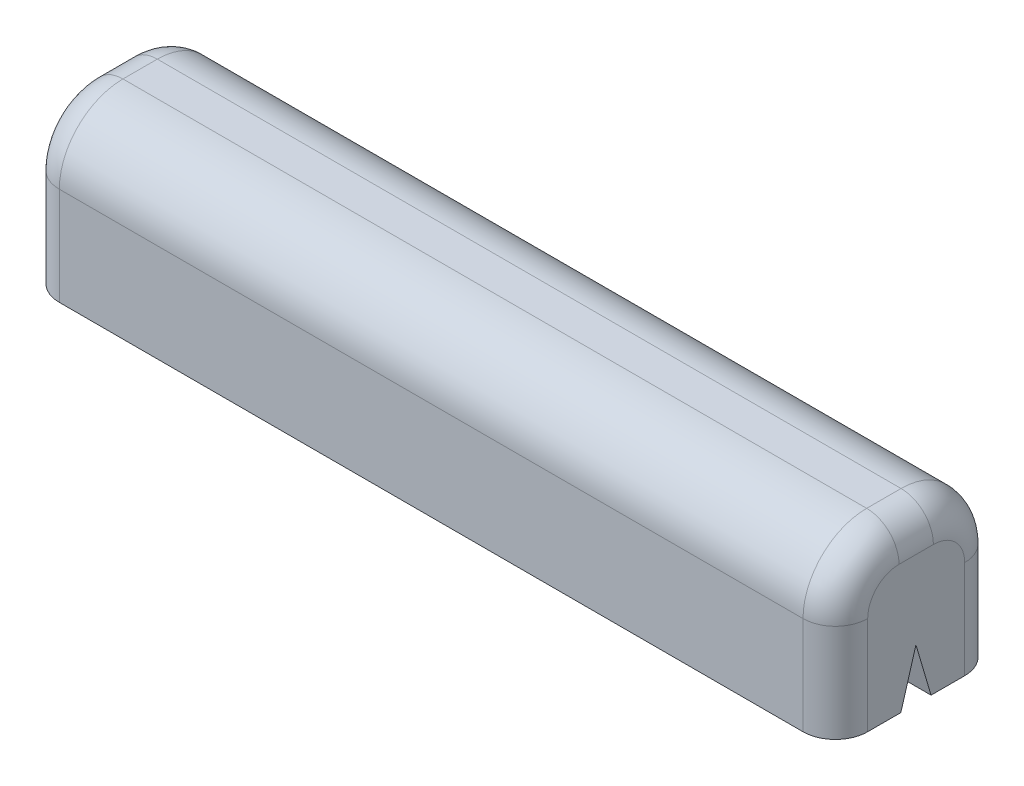
from build123d import *

# Parameters (mm, degrees)
BOSS_EXTRUDE1_DEPTH = 127
FILLET1_R           = 10.000000066
FILLET2_R           = 5.08


with BuildPart() as part:
    # Sketch1 → Boss-Extrude1 (new body)
    with BuildSketch(Plane(origin=(0, 0, 0), x_dir=(0, 0, -1), z_dir=(1, 0, 0))):
        Polygon((-4.750010552, 0), (-2.375005276, 8.038487043), (0, 0), (10.362989448, 0), (10.362989448, 25.4), (-15.037010552, 25.4), (-15.037010552, 0), align=None)
    extrude(amount=BOSS_EXTRUDE1_DEPTH)

    # Fillet1
    fillet1_edges = [part.edges().sort_by_distance(p)[0] for p in [
        (63.5, 25.4, 15.037010552),
        (63.5, 25.4, -10.362989448),
    ]]
    fillet(fillet1_edges, radius=FILLET1_R)

    # Fillet2
    fillet2_edges = [part.edges().sort_by_distance(p)[0] for p in [
        (0, 7.699999967, 15.037010552),
        (127, 7.699999967, 15.037010552),
        (0, 25.4, 2.337010552),
        (0, 22.471067793, -7.434057241),
        (0, 22.471067793, 12.108078344),
        (127, 25.4, 2.337010552),
        (127, 22.471067793, -7.434057241),
        (127, 22.471067793, 12.108078344),
        (127, 7.699999967, -10.362989448),
        (0, 7.699999967, -10.362989448),
    ]]
    fillet(fillet2_edges, radius=FILLET2_R)


solid = part.part
